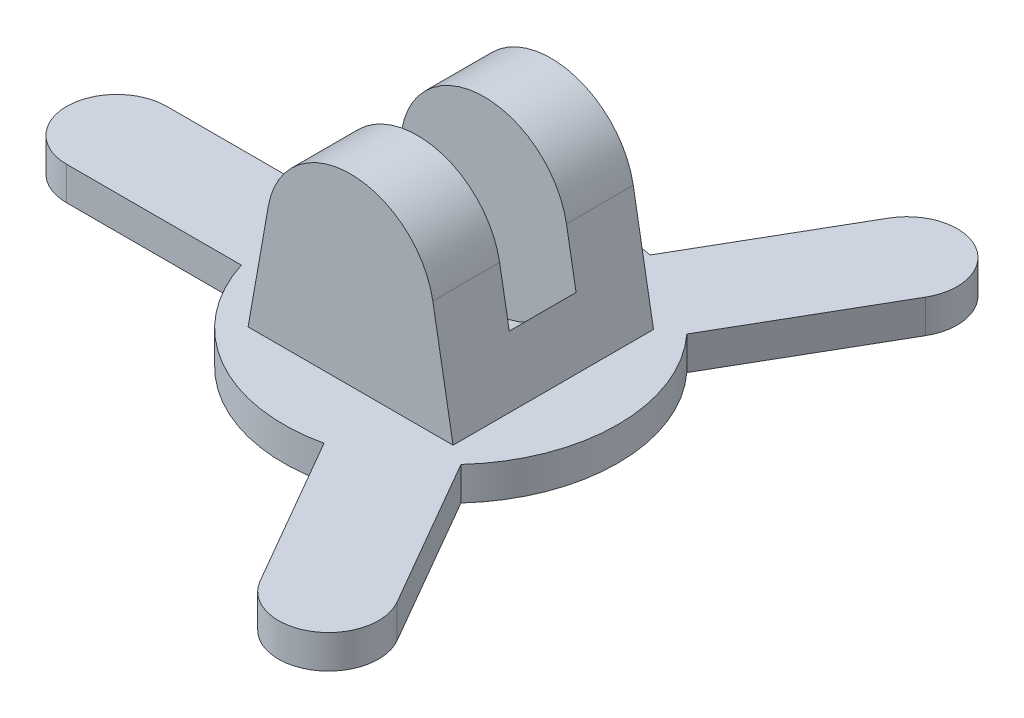
from build123d import *
from build123d.topology import SkipClean

# Parameters (mm, degrees)
BOSS_EXTRUDE1_DEPTH = 15
CUT_EXTRUDE1_DEPTH  = 5
BOSS_EXTRUDE2_DEPTH = 5
SKETCH3_R           = 15
CUT_EXTRUDE2_DEPTH  = 10


with BuildPart() as part:
    # Sketch1 → Boss-Extrude1 (new, symmetric)
    with BuildSketch(Plane.XY):
        with BuildLine():
            Line((-12.310096913, 2.170602221), (12.310096913, 2.170602221))
            ThreePointArc((12.310096913, 2.170602221), (0, -12.5), (-12.310096913, 2.170602221))
        make_face()
        with BuildLine():
            ThreePointArc((12.310096913, 2.170602221), (0, 12.5), (-12.310096913, 2.170602221))
            Line((-12.310096913, 2.170602221), (12.310096913, 2.170602221))
        make_face()
        with BuildLine():
            ThreePointArc((-12.310096913, 2.170602221), (0, -12.5), (12.310096913, 2.170602221))
            Line((12.310096913, 2.170602221), (15.337737359, -15))
            Line((15.337737359, -15), (-15.337737359, -15))
            Line((-15.337737359, -15), (-12.310096913, 2.170602221))
        make_face()
    extrude(amount=BOSS_EXTRUDE1_DEPTH, both=True)

    # Sketch1<3> → Cut-Extrude1 (cut, symmetric)
    with SkipClean():  # the faces are left unmerged after this step: merging them gives an invalid solid
        with BuildSketch(Plane.XY):
            with BuildLine():
                ThreePointArc((12.310096913, 2.170602221), (0, 12.5), (-12.310096913, 2.170602221))
                Line((-12.310096913, 2.170602221), (12.310096913, 2.170602221))
            make_face()
            with BuildLine():
                Line((-12.310096913, 2.170602221), (12.310096913, 2.170602221))
                ThreePointArc((12.310096913, 2.170602221), (0, -12.5), (-12.310096913, 2.170602221))
            make_face()
        extrude(amount=CUT_EXTRUDE1_DEPTH, both=True, mode=Mode.SUBTRACT)

    # Sketch2 → Boss-Extrude2 (add)
    with BuildSketch(Plane.XZ.offset(15)):
        with BuildLine():
            Line((-50, -7.5), (-23.848480035, -7.5))
            ThreePointArc((-23.848480035, -7.5), (-25, 0), (-23.848480035, 7.5))
            Line((-23.848480035, 7.5), (-50, 7.5))
            ThreePointArc((-50, 7.5), (-57.5, 0), (-50, -7.5))
        make_face()
        with BuildLine():
            Line((-23.848480035, -7.5), (-15.337737359, -7.5))
            Line((-15.337737359, -7.5), (-15.337737359, 7.5))
            Line((-15.337737359, 7.5), (-23.848480035, 7.5))
            ThreePointArc((-23.848480035, 7.5), (-25, 0), (-23.848480035, -7.5))
        make_face()
        with BuildLine():
            Line((-23.848480035, 7.5), (-15.337737359, 7.5))
            Line((-15.337737359, 7.5), (-15.337737359, 15))
            Line((-15.337737359, 15), (0, 15))
            Line((0, 15), (5.429049489, 24.403389552))
            ThreePointArc((5.429049489, 24.403389552), (-12.5, 21.650635095), (-23.848480035, 7.5))
        make_face()
        with BuildLine():
            ThreePointArc((5.429049489, 24.403389552), (12.5, 21.650635095), (18.419430546, 16.903389552))
            Line((18.419430546, 16.903389552), (31.495190528, 39.551270189))
            ThreePointArc((31.495190528, 39.551270189), (28.75, 49.796460718), (18.504809472, 47.051270189))
            Line((18.504809472, 47.051270189), (5.429049489, 24.403389552))
        make_face()
        with BuildLine():
            Line((15.337737359, 15), (15.337737359, 11.565740379))
            Line((15.337737359, 11.565740379), (18.419430546, 16.903389552))
            ThreePointArc((18.419430546, 16.903389552), (12.5, 21.650635095), (5.429049489, 24.403389552))
            Line((5.429049489, 24.403389552), (0, 15))
            Line((0, 15), (15.337737359, 15))
        make_face()
        with BuildLine():
            Line((18.419430546, 16.903389552), (15.337737359, 11.565740379))
            Line((15.337737359, 11.565740379), (15.337737359, -11.565740379))
            Line((15.337737359, -11.565740379), (18.419430546, -16.903389552))
            ThreePointArc((18.419430546, -16.903389552), (23.296842744, -9.069571003), (25, 0))
            ThreePointArc((25, 0), (23.296842744, 9.069571003), (18.419430546, 16.903389552))
        make_face()
        with BuildLine():
            ThreePointArc((6.495190528, -3.75), (3.75, -6.495190528), (0, -7.5))
            Line((0, -7.5), (-4.330127019, -7.5))
            Line((-4.330127019, -7.5), (0, -15))
            Line((0, -15), (15.337737359, -15))
            Line((15.337737359, -15), (15.337737359, -11.565740379))
            Line((15.337737359, -11.565740379), (8.660254038, 0))
            Line((8.660254038, 0), (6.495190528, -3.75))
        make_face()
        with BuildLine():
            Line((15.337737359, -15), (0, -15))
            Line((0, -15), (5.429049489, -24.403389552))
            ThreePointArc((5.429049489, -24.403389552), (12.5, -21.650635095), (18.419430546, -16.903389552))
            Line((18.419430546, -16.903389552), (15.337737359, -11.565740379))
            Line((15.337737359, -11.565740379), (15.337737359, -15))
        make_face()
        with BuildLine():
            ThreePointArc((18.419430546, -16.903389552), (12.5, -21.650635095), (5.429049489, -24.403389552))
            Line((5.429049489, -24.403389552), (18.504809472, -47.051270189))
            ThreePointArc((18.504809472, -47.051270189), (28.75, -49.796460718), (31.495190528, -39.551270189))
            Line((31.495190528, -39.551270189), (18.419430546, -16.903389552))
        make_face()
        with BuildLine():
            Line((-15.337737359, -15), (-15.337737359, -7.5))
            Line((-15.337737359, -7.5), (-23.848480035, -7.5))
            ThreePointArc((-23.848480035, -7.5), (-12.5, -21.650635095), (5.429049489, -24.403389552))
            Line((5.429049489, -24.403389552), (0, -15))
            Line((0, -15), (-15.337737359, -15))
        make_face()
        Polygon((0, -15), (-4.330127019, -7.5), (-15.337737359, -7.5), (-15.337737359, -15), align=None)
        with BuildLine():
            Line((-15.337737359, -7.5), (-4.330127019, -7.5))
            Line((-4.330127019, -7.5), (-6.495190528, -3.75))
            ThreePointArc((-6.495190528, -3.75), (-7.5, 0), (-6.495190528, 3.75))
            Line((-6.495190528, 3.75), (-4.330127019, 7.5))
            Line((-4.330127019, 7.5), (-15.337737359, 7.5))
            Line((-15.337737359, 7.5), (-15.337737359, -7.5))
        make_face()
        Polygon((-15.337737359, 15), (-15.337737359, 7.5), (-4.330127019, 7.5), (0, 15), align=None)
        with BuildLine():
            Line((6.495190528, 3.75), (8.660254038, 0))
            Line((8.660254038, 0), (15.337737359, 11.565740379))
            Line((15.337737359, 11.565740379), (15.337737359, 15))
            Line((15.337737359, 15), (0, 15))
            Line((0, 15), (-4.330127019, 7.5))
            Line((-4.330127019, 7.5), (0, 7.5))
            ThreePointArc((0, 7.5), (3.75, 6.495190528), (6.495190528, 3.75))
        make_face()
        Polygon((15.337737359, 11.565740379), (8.660254038, 0), (15.337737359, -11.565740379), align=None)
        with BuildLine():
            ThreePointArc((6.495190528, 3.75), (7.5, 0), (6.495190528, -3.75))
            Line((6.495190528, -3.75), (8.660254038, 0))
            Line((8.660254038, 0), (6.495190528, 3.75))
        make_face()
        with BuildLine():
            ThreePointArc((-6.495190528, -3.75), (-3.75, -6.495190528), (0, -7.5))
            ThreePointArc((0, -7.5), (3.75, -6.495190528), (6.495190528, -3.75))
            ThreePointArc((6.495190528, -3.75), (7.5, 0), (6.495190528, 3.75))
            ThreePointArc((6.495190528, 3.75), (3.75, 6.495190528), (0, 7.5))
            ThreePointArc((0, 7.5), (-3.75, 6.495190528), (-6.495190528, 3.75))
            ThreePointArc((-6.495190528, 3.75), (-7.5, 0), (-6.495190528, -3.75))
        make_face()
        with BuildLine():
            Line((-4.330127019, -7.5), (0, -7.5))
            ThreePointArc((0, -7.5), (-3.75, -6.495190528), (-6.495190528, -3.75))
            Line((-6.495190528, -3.75), (-4.330127019, -7.5))
        make_face()
        with BuildLine():
            Line((-4.330127019, 7.5), (-6.495190528, 3.75))
            ThreePointArc((-6.495190528, 3.75), (-3.75, 6.495190528), (0, 7.5))
            Line((0, 7.5), (-4.330127019, 7.5))
        make_face()
    extrude(amount=BOSS_EXTRUDE2_DEPTH)

    # Sketch3 → Cut-Extrude2 (cut)
    with BuildSketch(Plane.XY.offset(-5)):
        Circle(SKETCH3_R)
    extrude(amount=CUT_EXTRUDE2_DEPTH, mode=Mode.SUBTRACT)


solid = part.part
